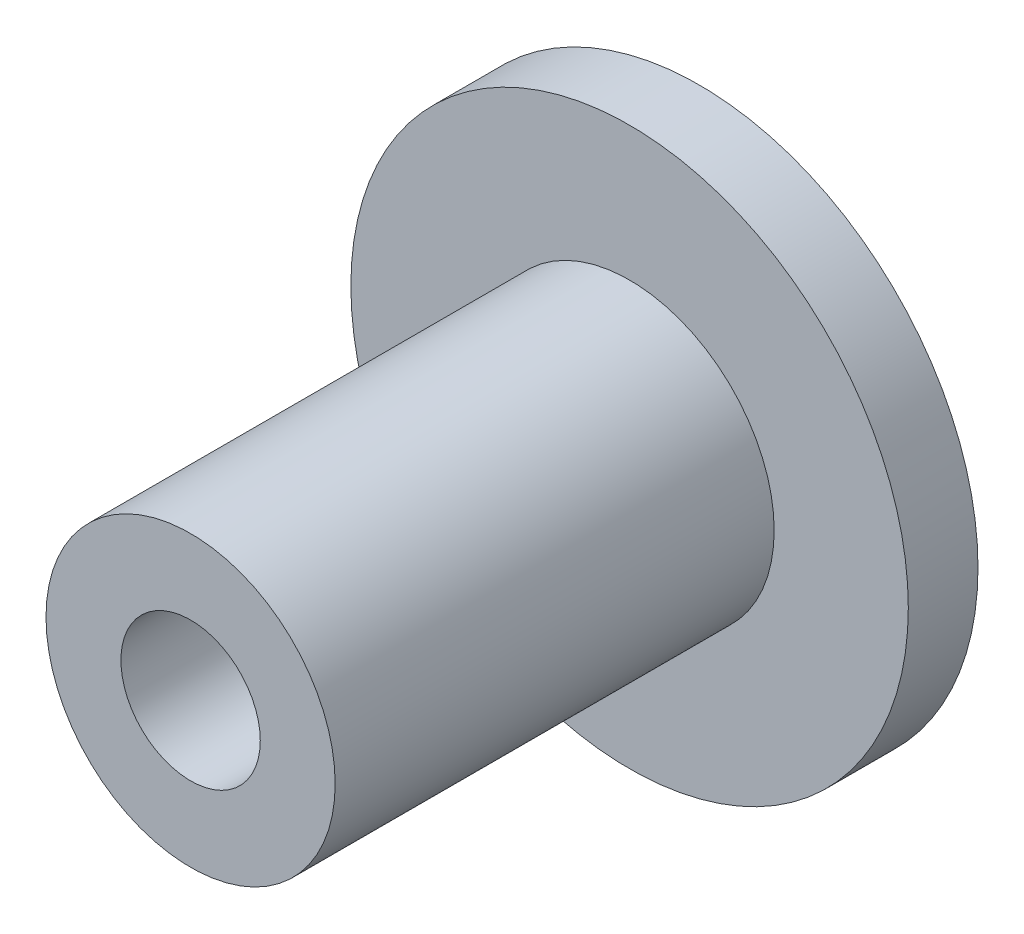
from build123d import *

# Parameters (mm, degrees)
FLANGE_SKETCH_R      = 4
FLANGE_EXTRUDE_DEPTH = 0.5
JOINT_SKETCH_R       = 2.075
JOINT_EXTRUDE_DEPTH  = 6.3
HOLE_SKETCH_R        = 1
HOLE_EXTRUDE_DEPTH   = 10.235258524


with BuildPart() as part:
    # Flange Sketch → Flange Extrude (new, symmetric)
    with BuildSketch(Plane.XY):
        Circle(FLANGE_SKETCH_R)
    extrude(amount=FLANGE_EXTRUDE_DEPTH, both=True)

    # Joint Sketch → Joint Extrude (add)
    with BuildSketch(Plane.XY.offset(0.5)):
        Circle(JOINT_SKETCH_R)
    extrude(amount=JOINT_EXTRUDE_DEPTH)

    # Hole Sketch → Hole Extrude (cut, through all)
    with BuildSketch(Plane.XY.offset(6.8)):
        Circle(HOLE_SKETCH_R)
    extrude(amount=-HOLE_EXTRUDE_DEPTH, mode=Mode.SUBTRACT)


solid = part.part
